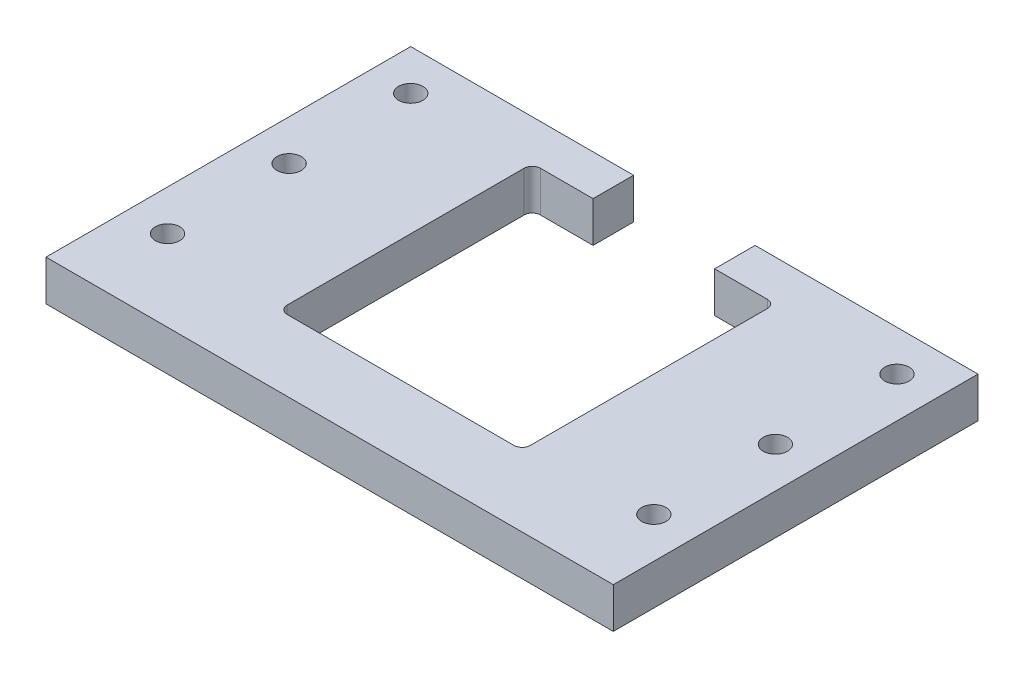
from build123d import *

# Parameters (mm, degrees)
SKETCH1_R           = 3.81
BOSS_EXTRUDE1_DEPTH = 12.7


with BuildPart() as part:
    # Sketch1 → Boss-Extrude1 (new body)
    with BuildSketch(Plane(origin=(0, 0, 0), x_dir=(1, 0, 0), z_dir=(0, 1, 0))):
        with BuildLine():
            Line((92.067570855, 107.193983746), (161.917570855, 107.193983746))
            Line((161.917570855, 107.193983746), (161.917570855, -7.106016254))
            Line((161.917570855, -7.106016254), (-15.882429145, -7.106016254))
            Line((-15.882429145, -7.106016254), (-15.882429145, 107.193983746))
            Line((-15.882429145, 107.193983746), (53.967570855, 107.193983746))
            Line((53.967570855, 107.193983746), (53.967570855, 94.493983746))
            Line((53.967570855, 94.493983746), (37.457570855, 94.493983746))
            ThreePointArc((37.457570855, 94.493983746), (35.661519631, 93.75003497), (34.917570855, 91.953983746))
            Line((34.917570855, 91.953983746), (34.917570855, 17.658983746))
            ThreePointArc((34.917570855, 17.658983746), (35.661519631, 15.862932521), (37.457570855, 15.118983746))
            Line((37.457570855, 15.118983746), (108.577570855, 15.118983746))
            ThreePointArc((108.577570855, 15.118983746), (110.373622079, 15.862932521), (111.117570855, 17.658983746))
            Line((111.117570855, 17.658983746), (111.117570855, 91.953983746))
            ThreePointArc((111.117570855, 91.953983746), (110.373622079, 93.75003497), (108.577570855, 94.493983746))
            Line((108.577570855, 94.493983746), (92.067570855, 94.493983746))
            Line((92.067570855, 94.493983746), (92.067570855, 107.193983746))
        make_face()
        with Locations(Location((-3.182429145, 94.493983746, 0), (0, 0, 270))):
            Circle(SKETCH1_R, mode=Mode.SUBTRACT)
        with Locations(Location((-3.182429145, 56.393983746, 0), (0, 0, 270))):
            Circle(SKETCH1_R, mode=Mode.SUBTRACT)
        with Locations(Location((-3.182429145, 18.293983746, 0), (0, 0, 270))):
            Circle(SKETCH1_R, mode=Mode.SUBTRACT)
        with Locations(Location((149.217570855, 94.493983746, 0), (0, 0, 90))):
            Circle(SKETCH1_R, mode=Mode.SUBTRACT)
        with Locations(Location((149.217570855, 56.393983746, 0), (0, 0, 90))):
            Circle(SKETCH1_R, mode=Mode.SUBTRACT)
        with Locations(Location((149.217570855, 18.293983746, 0), (0, 0, 90))):
            Circle(SKETCH1_R, mode=Mode.SUBTRACT)
    extrude(amount=BOSS_EXTRUDE1_DEPTH)


solid = part.part
